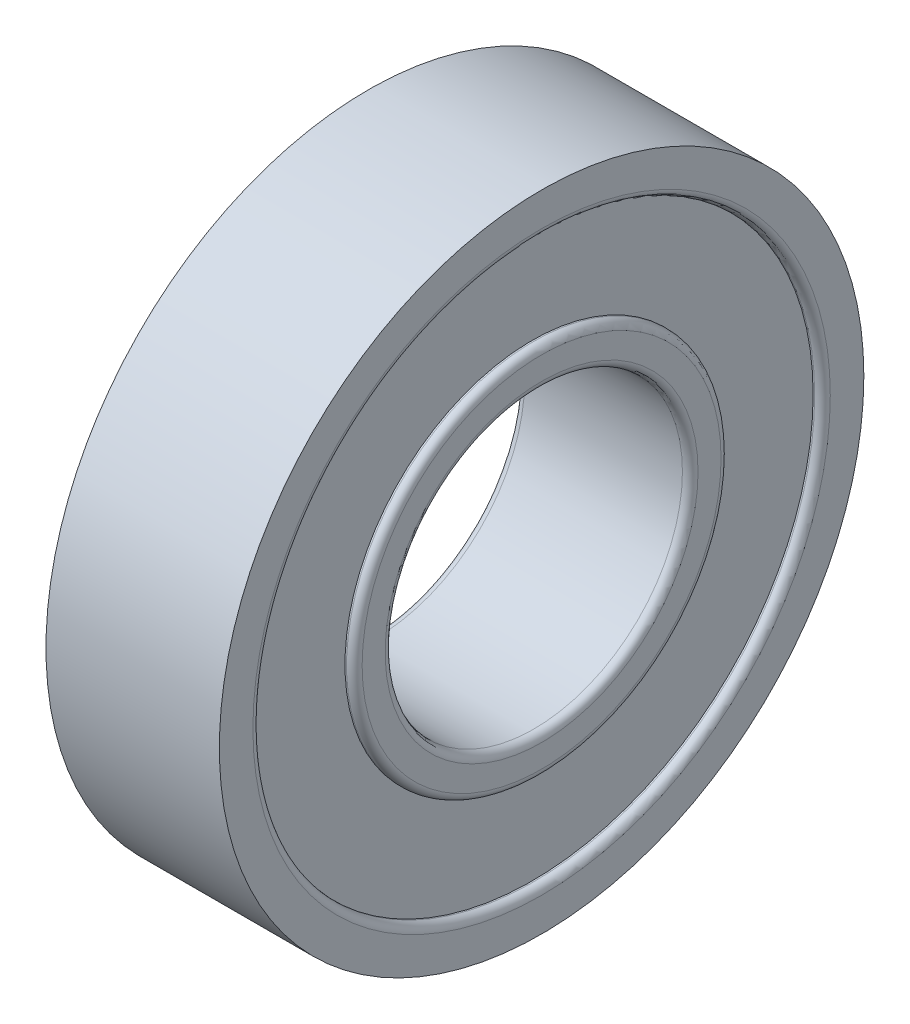
from build123d import *

# Parameters (mm, degrees)
CROQUIS1_R              = 20.65
CROQUIS1_R_2            = 9.525
SALIENTE_EXTRUIR1_DEPTH = 5.555
CROQUIS2_R              = 18
CROQUIS2_R_2            = 12
CORTAR_EXTRUIR1_DEPTH   = 0.6
REDONDEO1_R             = 0.5


with BuildPart() as part:
    # Croquis1 → Saliente-Extruir1 (new, symmetric)
    with BuildSketch(Plane(origin=(0, 0, 0), x_dir=(0, 0, -1), z_dir=(1, 0, 0))):
        Circle(CROQUIS1_R)
        Circle(CROQUIS1_R_2, mode=Mode.SUBTRACT)
    extrude(amount=SALIENTE_EXTRUIR1_DEPTH, both=True)

    # Croquis2 → Cortar-Extruir1 (cut)
    with BuildSketch(Plane(origin=(5.555, 0, 0), x_dir=(0, 0, -1), z_dir=(1, 0, 0))):
        Circle(CROQUIS2_R)
        Circle(CROQUIS2_R_2, mode=Mode.SUBTRACT)
    cortar_extruir1 = extrude(amount=-CORTAR_EXTRUIR1_DEPTH, mode=Mode.SUBTRACT)

    # Simetría2: Cortar-Extruir1 across plane
    add(cortar_extruir1.mirror(Plane(origin=(0, 0, 0), x_dir=(0, 0, 1), z_dir=(1, 0, 0))), mode=Mode.SUBTRACT)

    # Redondeo1
    redondeo1_edges = [part.edges().sort_by_distance(p)[0] for p in [
        (5.555, 0, 18),
        (5.555, 0, 12),
        (-5.555, 0, 12),
        (-5.555, 0, 18),
        (-5.555, 0, 9.525),
        (5.555, 0, 9.525),
    ]]
    fillet(redondeo1_edges, radius=REDONDEO1_R)


solid = part.part
